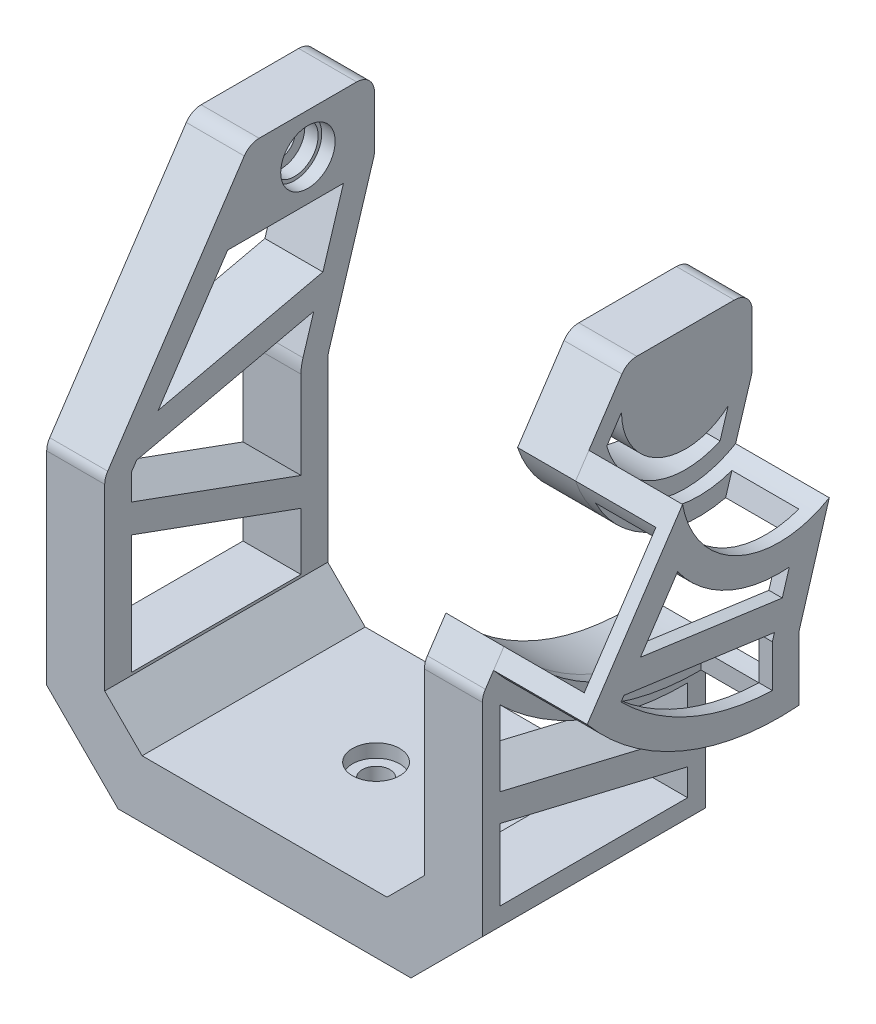
from build123d import *

# Parameters (mm, degrees)
BOSS_EXTRUDE1_DEPTH     = 25
BOSS_EXTRUDE2_DEPTH     = 6.5
BOSS_EXTRUDE3_START     = -6.5
BOSS_EXTRUDE3_DEPTH     = 6.5
FILLET1_R               = 2
CUT_EXTRUDE2_REACH      = 80.173
CUT_EXTRUDE1_DEPTH      = 37.33
CUT_EXTRUDE1_DEPTH_BACK = 1.5
SKETCH5_R               = 3.05
CUT_EXTRUDE3_REACH      = 80.173
BOSS_EXTRUDE5_DEPTH     = 9
BOSS_EXTRUDE5_2_DEPTH   = 9
CUT_EXTRUDE6_DEPTH      = 7.5
BOSS_EXTRUDE6_DEPTH     = 1.5
CUT_EXTRUDE4_START      = -17.692388
CUT_EXTRUDE4_DEPTH      = 17.692388
SKETCH13_R              = 3.05
CUT_EXTRUDE7_DEPTH      = 2
SKETCH15_R              = 1.55
CUT_EXTRUDE8_DEPTH      = 3
SKETCH12_R              = 4.5
CUT_EXTRUDE9_DEPTH      = 2
SKETCH12_3_R            = 1.55
CUT_EXTRUDE10_DEPTH     = 6.5
SKETCH12_5_R            = 4.5
SKETCH12_5_R_2          = 1.55
CUT_EXTRUDE11_DEPTH     = 2.5
SKETCH16_R              = 2.65
CUT_EXTRUDE12_DEPTH     = 1.5
SKETCH17_R              = 2.65
CUT_EXTRUDE13_DEPTH     = 1.5


with BuildPart() as part:
    # Sketch1 → Boss-Extrude1 (new body)
    with BuildSketch(Plane.XY):
        Polygon((16.415, 0), (-16.415, 0), (-24.415, 8), (-24.415, 10.692388155), (-17.915, 10.692388155), (-13.722611845, 6.5), (13.722611845, 6.5), (17.915, 10.692388155), (24.415, 10.692388155), (24.415, 8), align=None)
    extrude(amount=BOSS_EXTRUDE1_DEPTH)

    # Sketch2 → Boss-Extrude2 (add)
    with BuildSketch(Plane.ZY.offset(24.415)):
        with BuildLine():
            Line((8.761146261, 55.692388155), (25, 31.355739178))
            Line((25, 31.355739178), (25, 10.692388155))
            Line((25, 10.692388155), (0, 10.692388155))
            Line((0, 10.692388155), (0, 30.746169927))
            Line((0, 30.746169927), (-5.238853739, 47.692388155))
            Line((-5.238853739, 47.692388155), (-5.238853739, 53.692388155))
            ThreePointArc((-5.238853739, 53.692388155), (-4.653067302, 55.106601718), (-3.238853739, 55.692388155))
            Line((-3.238853739, 55.692388155), (8.761146261, 55.692388155))
        make_face()
    extrude(amount=-BOSS_EXTRUDE2_DEPTH)

    # Sketch3 → Boss-Extrude3 (add)
    with BuildSketch(Plane(origin=(24.415, 0, 0), x_dir=(0, 0, -1), z_dir=(1, 0, 0)).offset(BOSS_EXTRUDE3_START)):
        with BuildLine():
            Line((3.238853739, 55.692388155), (-8.761146261, 55.692388155))
            Line((-8.761146261, 55.692388155), (-25, 31.355739178))
            Line((-25, 31.355739178), (-25, 10.692388155))
            Line((-25, 10.692388155), (0, 10.692388155))
            Line((0, 10.692388155), (0, 30.746169927))
            Line((0, 30.746169927), (5.238853739, 47.692388155))
            Line((5.238853739, 47.692388155), (5.238853739, 53.692388155))
            ThreePointArc((5.238853739, 53.692388155), (4.653067302, 55.106601718), (3.238853739, 55.692388155))
        make_face()
    extrude(amount=BOSS_EXTRUDE3_DEPTH)

    # Fillet1
    fillet1_edges = [part.edges().sort_by_distance(p)[0] for p in [
        (-21.165, 30.746169927, 0),
        (-21.165, 47.692388155, -5.238853739),
        (-21.165, 55.692388155, 8.761146261),
        (-21.165, 31.355739178, 25),
        (21.165, 47.692388155, -5.238853739),
        (21.165, 30.746169927, 0),
        (21.165, 31.355739178, 25),
        (21.165, 55.692388155, 8.761146261),
    ]]
    fillet(fillet1_edges, radius=FILLET1_R)

    # Sketch6 → Cut-Extrude2 (cut, up to next)
    with BuildSketch(Plane.ZY.offset(24.415), mode=Mode.PRIVATE) as cut_extrude2_sk1:
        with BuildLine():
            Line((1.569642128, 35.826114392), (21.42588199, 31.307152875))
            Line((21.42588199, 31.307152875), (22, 30.446740637))
            Line((22, 30.446740637), (22, 27.533867699))
            Line((22, 27.533867699), (3, 20.618433248))
            Line((3, 20.618433248), (3, 30.444077201))
            ThreePointArc((3, 30.444077201), (2.943920281, 31.19083838), (2.776939097, 31.920848296))
            Line((2.776939097, 31.920848296), (1.569642128, 35.826114392))
        make_face()
    cut_extrude2_tool1 = extrude(cut_extrude2_sk1.sketch, amount=-CUT_EXTRUDE2_REACH, mode=Mode.PRIVATE) & part.part
    # Sketch6 → Cut-Extrude2 (cut, up to next)
    with BuildSketch(Plane.ZY.offset(24.415), mode=Mode.PRIVATE) as cut_extrude2_sk2:
        Polygon((3, 17.42589993), (3, 11), (22, 11), (22, 24.341334381), align=None)
    cut_extrude2_tool2 = extrude(cut_extrude2_sk2.sketch, amount=-CUT_EXTRUDE2_REACH, mode=Mode.PRIVATE) & part.part
    # Sketch6 → Cut-Extrude2 (cut, up to next)
    with BuildSketch(Plane.ZY.offset(24.415), mode=Mode.PRIVATE) as cut_extrude2_sk3:
        Polygon((11.226667615, 46.592388155), (19.005340922, 34.934740096), (0.546505101, 39.13567488), (-1.758707171, 46.592388155), align=None)
    cut_extrude2_tool3 = extrude(cut_extrude2_sk3.sketch, amount=-CUT_EXTRUDE2_REACH, mode=Mode.PRIVATE) & part.part
    add(cut_extrude2_tool1.solids().sort_by_distance((-24.415, 28.670214, 10.425803))[0], mode=Mode.SUBTRACT)
    add(cut_extrude2_tool2.solids().sort_by_distance((-24.415, 16.143418, 13.607837))[0], mode=Mode.SUBTRACT)
    add(cut_extrude2_tool3.solids().sort_by_distance((-24.415, 41.56792, 7.860318))[0], mode=Mode.SUBTRACT)

    # Sketch5 → Cut-Extrude1 (cut, two sides: drawn at the far end of the back side and taken through both)
    with BuildSketch(Plane(origin=(-17.915, 0, 0), x_dir=(0, 0, -1), z_dir=(1, 0, 0)).offset(-CUT_EXTRUDE1_DEPTH_BACK)):
        with Locations((-2.226226271, 51.142388155)):
            Circle(SKETCH5_R)
    extrude(amount=CUT_EXTRUDE1_DEPTH + CUT_EXTRUDE1_DEPTH_BACK, mode=Mode.SUBTRACT)

    # Sketch7 → Cut-Extrude3 (cut, up to next)
    with BuildSketch(Plane(origin=(24.415, 0, 0), x_dir=(0, 0, -1), z_dir=(1, 0, 0)), mode=Mode.PRIVATE) as cut_extrude3_sk1:
        with BuildLine():
            Line((-14.55281664, 47.012597619), (-22.586531815, 34.972726496))
            ThreePointArc((-22.586531815, 34.972726496), (-12.517147122, 27.265685116), (0, 25.237872785))
            Line((0, 25.237872785), (0, 30.444077201))
            ThreePointArc((0, 30.444077201), (0.022431888, 30.742781672), (0.089224361, 31.034785639))
            Line((0.089224361, 31.034785639), (0.821105182, 33.402214227))
            Line((0.821105182, 33.402214227), (2.570035889, 39.059513113))
            ThreePointArc((2.570035889, 39.059513113), (-7.702479463, 39.352110339), (-14.55281664, 47.012597619))
        make_face()
    cut_extrude3_tool1 = extrude(cut_extrude3_sk1.sketch, amount=-CUT_EXTRUDE3_REACH, mode=Mode.PRIVATE) & part.part
    add(cut_extrude3_tool1.solids().sort_by_distance((24.415, 34.21074, 9.961311))[0], mode=Mode.SUBTRACT)


with BuildPart() as cut_extrude3_piece_1:
    # of the separate pieces the step leaves, piece 1, a body of its own (cut_extrude3_pieces)
    add(part.part.solids().sort_by_distance((-24.415, 30.749740151, 25))[0])


with BuildPart() as cut_extrude3_piece_2:
    # of the separate pieces the step leaves, piece 2, a body of its own (cut_extrude3_pieces)
    add(part.part.solids().sort_by_distance((24.415, 39.059513113, -2.570035889))[0])


with BuildPart() as body_3:
    # Sketch7<4> → Boss-Extrude5 (new body)
    with BuildSketch(Plane(origin=(24.415, 0, 0), x_dir=(0, 0, -1), z_dir=(1, 0, 0))):
        with BuildLine():
            Line((-13.061740142, 49.247226116), (-14.55281664, 47.012597619))
            ThreePointArc((-14.55281664, 47.012597619), (-7.702479463, 39.352110339), (2.570035889, 39.059513113))
            Line((2.570035889, 39.059513113), (3.379513368, 41.67794506))
            ThreePointArc((3.379513368, 41.67794506), (-6.826350026, 41.150448332), (-13.061740142, 49.247226116))
        make_face()
    extrude(amount=BOSS_EXTRUDE5_DEPTH)


with BuildPart() as body_4:
    # Sketch7<4> → Boss-Extrude5 2 (new body)
    with BuildSketch(Plane(origin=(24.415, 0, 0), x_dir=(0, 0, -1), z_dir=(1, 0, 0))):
        with BuildLine():
            Line((-22.586531815, 34.972726496), (-23.74834953, 33.231547571))
            ThreePointArc((-23.74834953, 33.231547571), (-13.092941427, 25.337068903), (0, 23.231029955))
            Line((0, 23.231029955), (0, 25.237872785))
            ThreePointArc((0, 25.237872785), (-12.517147122, 27.265685116), (-22.586531815, 34.972726496))
        make_face()
    extrude(amount=BOSS_EXTRUDE5_2_DEPTH)


with BuildPart() as cut_extrude6_tool:
    # Sketch11 → Cut-Extrude6 (new body)
    with BuildSketch(Plane(origin=(33.415, 0, 0), x_dir=(0, 0, -1), z_dir=(1, 0, 0))):
        with BuildLine():
            Line((-12.503581313, 47.221167256), (-13.816181623, 45.254015295))
            ThreePointArc((-13.816181623, 45.254015295), (-7.698431629, 39.350231079), (0.759788142, 38.489968706))
            Line((0.759788142, 38.489968706), (1.468152482, 40.781328092))
            ThreePointArc((1.468152482, 40.781328092), (-6.830764936, 41.152482066), (-12.503581313, 47.221167256))
        make_face()
        with BuildLine():
            Line((-1.997924273, 25.143390517), (-1.997924273, 23.143318917))
            ThreePointArc((-1.997924273, 23.143318917), (-13.25695252, 25.406749861), (-22.660330699, 31.999572892))
            Line((-22.660330699, 31.999572892), (-21.517925704, 33.711658596))
            ThreePointArc((-21.517925704, 33.711658596), (-12.676445642, 27.334975127), (-1.997924273, 25.143390517))
        make_face()
    extrude(amount=-CUT_EXTRUDE6_DEPTH)


with BuildPart() as body_3_1:
    add(body_3.part)

    # Cut-Extrude6: cut by cut_extrude6_tool
    add(cut_extrude6_tool.part, mode=Mode.SUBTRACT)



with BuildPart() as body_4_1:
    add(body_4.part)

    # Cut-Extrude6: cut by cut_extrude6_tool
    add(cut_extrude6_tool.part, mode=Mode.SUBTRACT)


with BuildPart() as body_3_2:
    add(body_3_1.part)

    add(body_4_1.part)  # Boss-Extrude6 merges body 4
    # Sketch8 → Boss-Extrude6 (add)
    with BuildSketch(Plane(origin=(33.415, 0, 0), x_dir=(0, 0, -1), z_dir=(1, 0, 0))):
        with BuildLine():
            Line((3.379513368, 41.67794506), (0, 30.444077201))
            Line((0, 30.444077201), (0, 23.231029955))
            ThreePointArc((0, 23.231029955), (-13.092941427, 25.337068903), (-23.74834953, 33.231547571))
            Line((-23.74834953, 33.231547571), (-13.061740142, 49.247226116))
            ThreePointArc((-13.061740142, 49.247226116), (-6.826350026, 41.150448332), (3.379513368, 41.67794506))
        make_face()
    extrude(amount=BOSS_EXTRUDE6_DEPTH)


with BuildPart() as cut_extrude4_tool:
    # Sketch9 → Cut-Extrude4 (new body)
    with BuildSketch(Plane(origin=(34.915, 0, 0), x_dir=(0, 0, -1), z_dir=(1, 0, 0)).offset(CUT_EXTRUDE4_START)):
        with BuildLine():
            Line((1.63647369, 42.811232149), (2.554727759, 45.781525771))
            ThreePointArc((2.554727759, 45.781525771), (-5.152204716, 44.582280147), (-9.409245191, 51.117768242))
            Line((-9.409245191, 51.117768242), (-11.061998373, 48.640840086))
            ThreePointArc((-11.061998373, 48.640840086), (-6.057537249, 42.796750517), (1.63647369, 42.811232149))
        make_face()
        with BuildLine():
            Line((-17.77930117, 36.772166527), (-1.88957781, 34.576717357))
            Line((-1.88957781, 34.576717357), (-1.104192381, 37.187423449))
            ThreePointArc((-1.104192381, 37.187423449), (-8.128722858, 38.447486264), (-13.619453859, 43.006396198))
            Line((-13.619453859, 43.006396198), (-17.77930117, 36.772166527))
        make_face()
        with BuildLine():
            Line((-19.629517428, 33.999306796), (-2.764291486, 31.669074517))
            Line((-2.764291486, 31.669074517), (-3, 30.88555393))
            Line((-3, 30.88555393), (-3, 26.15436554))
            ThreePointArc((-3, 26.15436554), (-12.18169394, 28.210125653), (-19.95322132, 33.514182162))
            Line((-19.95322132, 33.514182162), (-19.629517428, 33.999306796))
        make_face()
        with BuildLine():
            Line((-23, 21.083861878), (-2, 16.083861878))
            Line((-2, 16.083861878), (-2, 21.14324114))
            ThreePointArc((-2, 21.14324114), (-13.316931605, 23.267735598), (-23, 29.498674864))
            Line((-23, 29.498674864), (-23, 21.083861878))
        make_face()
        Polygon((-23, 10), (-2, 10), (-2, 13), (-23, 18), align=None)
    extrude(amount=CUT_EXTRUDE4_DEPTH)


with BuildPart() as cut_extrude3_piece_1_1:
    add(cut_extrude3_piece_1.part)

    # Cut-Extrude4: cut by cut_extrude4_tool
    add(cut_extrude4_tool.part, mode=Mode.SUBTRACT)

    # Sketch13 → Cut-Extrude7 (cut)
    with BuildSketch(Plane.ZY.offset(24.415)):
        with Locations((2.226226271, 51.142388155)):
            Circle(SKETCH13_R)
    extrude(amount=-CUT_EXTRUDE7_DEPTH, mode=Mode.SUBTRACT)

    # Sketch15 → Cut-Extrude8 (cut)
    with BuildSketch(Plane.ZY.offset(22.415)):
        with Locations((2.226226271, 51.142388155)):
            Circle(SKETCH15_R)
    extrude(amount=-CUT_EXTRUDE8_DEPTH, mode=Mode.SUBTRACT)

    # Sketch12 → Cut-Extrude9 (cut)
    # profile 1 of 3: a face of its own
    with BuildSketch(Plane.XZ):
        with BuildLine():
            ThreePointArc((4.13067791, 16.5), (0, 18.25), (-4.13067791, 16.5))
            Line((-4.13067791, 16.5), (-10.13067791, 16.5))
            Line((-10.13067791, 16.5), (-16.415, 15.666681988))
            Line((-16.415, 15.666681988), (-16.415, 9.333318012))
            Line((-16.415, 9.333318012), (-10.13067791, 8.5))
            Line((-10.13067791, 8.5), (-4.13067791, 8.5))
            ThreePointArc((-4.13067791, 8.5), (0, 6.75), (4.13067791, 8.5))
            Line((4.13067791, 8.5), (10.13067791, 8.5))
            Line((10.13067791, 8.5), (16.415, 9.333318012))
            Line((16.415, 9.333318012), (16.415, 15.666681988))
            Line((16.415, 15.666681988), (10.13067791, 16.5))
            Line((10.13067791, 16.5), (4.13067791, 16.5))
        make_face()
        with Locations((0, 12.5)):
            Circle(SKETCH12_R, mode=Mode.SUBTRACT)
    # profile 2 of 3: a face of its own
    with BuildSketch(Plane.XZ):
        with BuildLine():
            Line((-16.415, 9.333318012), (-16.415, 15.666681988))
            Line((-16.415, 15.666681988), (-20.5, 15.125))
            ThreePointArc((-20.5, 15.125), (-23.125, 12.5), (-20.5, 9.875))
            Line((-20.5, 9.875), (-16.415, 9.333318012))
        make_face()
    # profile 3 of 3: a face of its own
    with BuildSketch(Plane.XZ):
        with BuildLine():
            Line((20.5, 15.125), (16.415, 15.666681988))
            Line((16.415, 15.666681988), (16.415, 9.333318012))
            Line((16.415, 9.333318012), (20.5, 9.875))
            ThreePointArc((20.5, 9.875), (23.125, 12.5), (20.5, 15.125))
        make_face()
    extrude(amount=-CUT_EXTRUDE9_DEPTH, mode=Mode.SUBTRACT)

    # Sketch12<3> → Cut-Extrude10 (cut)
    with BuildSketch(Plane.XZ):
        with Locations((0, 12.5)):
            Circle(SKETCH12_3_R)
    extrude(amount=-CUT_EXTRUDE10_DEPTH, mode=Mode.SUBTRACT)

    # Sketch12<5> → Cut-Extrude11 (cut)
    with BuildSketch(Plane.XZ):
        with Locations((0, 12.5)):
            Circle(SKETCH12_5_R)
        with Locations((0, 12.5)):
            Circle(SKETCH12_5_R_2, mode=Mode.SUBTRACT)
    extrude(amount=-CUT_EXTRUDE11_DEPTH, mode=Mode.SUBTRACT)

    # Sketch16 → Cut-Extrude12 (cut)
    with BuildSketch(Plane(origin=(0, 6.5, 0), x_dir=(1, 0, 0), z_dir=(0, 1, 0))):
        with Locations(Location((0, -12.5, 0), (0, 0, 180))):
            Circle(SKETCH16_R)
    extrude(amount=-CUT_EXTRUDE12_DEPTH, mode=Mode.SUBTRACT)

    # Sketch17 → Cut-Extrude13 (cut)
    with BuildSketch(Plane(origin=(-19.415, 0, 0), x_dir=(0, 0, -1), z_dir=(1, 0, 0))):
        with Locations((-2.226226271, 51.142388155)):
            Circle(SKETCH17_R)
    extrude(amount=-CUT_EXTRUDE13_DEPTH, mode=Mode.SUBTRACT)


with BuildPart() as cut_extrude3_piece_2_1:
    add(cut_extrude3_piece_2.part)

    # Cut-Extrude4: cut by cut_extrude4_tool
    add(cut_extrude4_tool.part, mode=Mode.SUBTRACT)


with BuildPart() as body_3_3:
    add(body_3_2.part)

    # Cut-Extrude4: cut by cut_extrude4_tool
    add(cut_extrude4_tool.part, mode=Mode.SUBTRACT)


solid = Compound([cut_extrude3_piece_1_1.part, cut_extrude3_piece_2_1.part, body_3_3.part])
